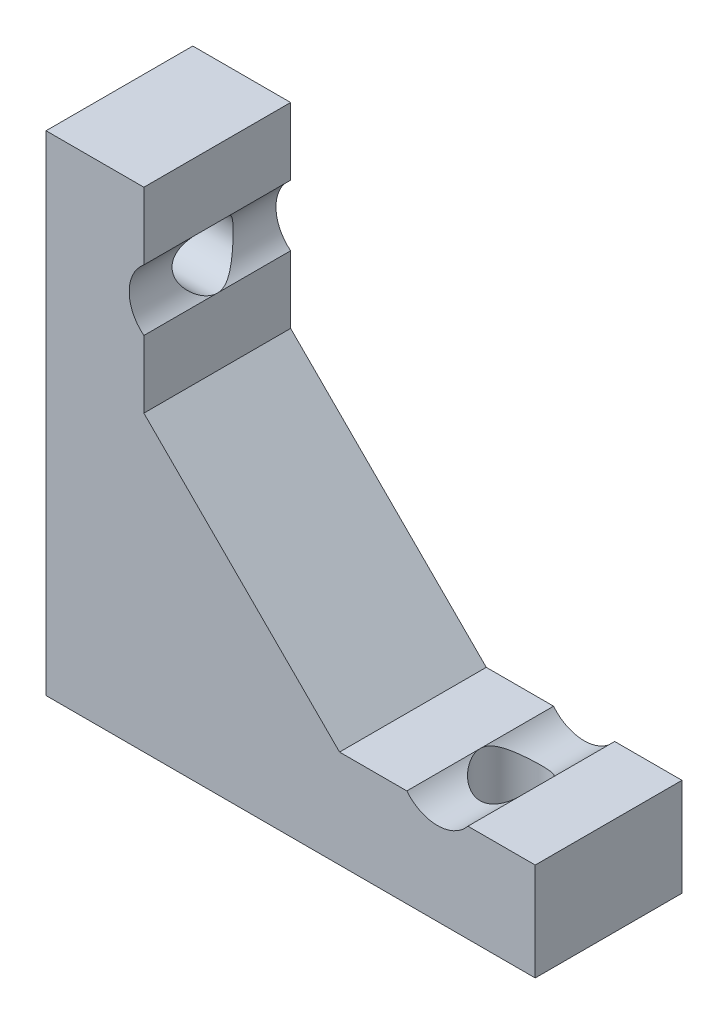
from build123d import *

# Parameters (mm, degrees)
SALIENTE_EXTRUIR1_DEPTH = 6
CROQUIS3_R              = 1.25
CORTAR_EXTRUIR1_DEPTH   = 4
CROQUIS4_R              = 1.25
CORTAR_EXTRUIR2_DEPTH   = 4
CROQUIS5_R              = 1.6
CORTAR_EXTRUIR3_DEPTH   = 6


with BuildPart() as part:
    # Croquis1 → Saliente-Extruir1 (new body)
    with BuildSketch(Plane.XY):
        Polygon((0, 0), (0, 20), (4, 20), (4, 12), (12, 4), (20, 4), (20, 0), align=None)
    extrude(amount=SALIENTE_EXTRUIR1_DEPTH)

    # Croquis3 → Cortar-Extruir1 (cut)
    with BuildSketch(Plane(origin=(0, 4, 0), x_dir=(1, 0, 0), z_dir=(0, 1, 0))):
        with Locations(Location((16, -3, 0), (0, 0, 180))):
            Circle(CROQUIS3_R)
    extrude(amount=-CORTAR_EXTRUIR1_DEPTH, mode=Mode.SUBTRACT)

    # Croquis4 → Cortar-Extruir2 (cut)
    with BuildSketch(Plane(origin=(4, 0, 0), x_dir=(0, 0, -1), z_dir=(1, 0, 0))):
        with Locations(Location((-3, 16, 0), (0, 0, 90))):
            Circle(CROQUIS4_R)
    extrude(amount=-CORTAR_EXTRUIR2_DEPTH, mode=Mode.SUBTRACT)

    # Croquis5 → Cortar-Extruir3 (cut)
    with BuildSketch(Plane.XY.offset(6)):
        with Locations((16, 5)):
            Circle(CROQUIS5_R)
        with Locations((5, 16)):
            Circle(CROQUIS5_R)
    extrude(amount=-CORTAR_EXTRUIR3_DEPTH, mode=Mode.SUBTRACT)


solid = part.part
